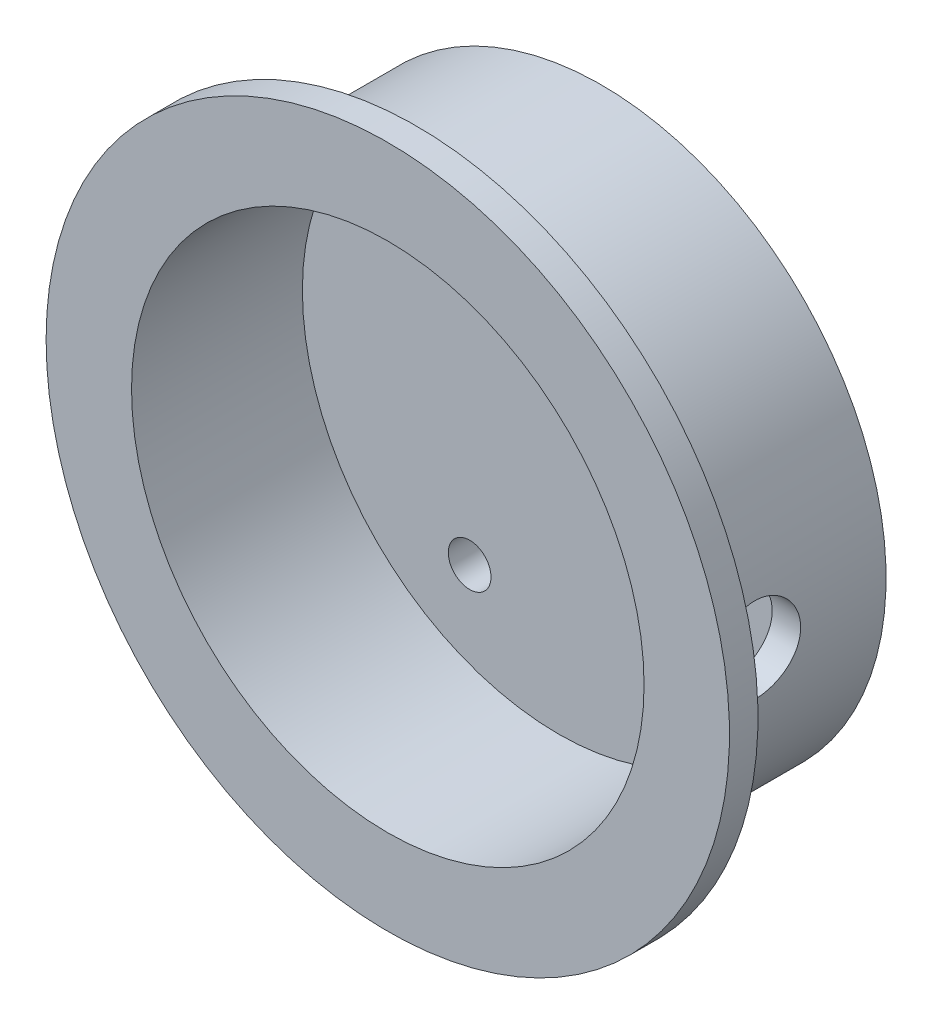
from build123d import *

# Parameters (mm, degrees)
SKETCH_3_R          = 3
CUT_EXTRUDE_1_DEPTH = 75.215901261
SKETCH_4_R          = 6
CUT_EXTRUDE_2_DEPTH = 6


with BuildPart() as part:
    # 草图2 → 旋转2 (revolve)
    with BuildSketch(Plane(origin=(0, 0, 0), x_dir=(1, 0, 0), z_dir=(0, 1, 0)), mode=Mode.PRIVATE) as revolve_2_sk:
        Polygon((0, 0), (40, 0), (40, -26), (48, -26), (48, -30), (36, -30), (36, -6), (0, -6), align=None)
    revolve(revolve_2_sk.sketch.rotate(Axis((0, 0, 0), (0, 0, 1)), 180), axis=Axis((0, 0, 0), (0, 0, 1)))

    # 草图3 → 切除-拉伸1 (cut, through all)
    with BuildSketch(Plane.XY):
        with Locations(Location((25, 0, 0), (0, 0, 180))):
            Circle(SKETCH_3_R)
        with Locations(Location((-12.5, 21.650635, 0), (0, 0, 180))):
            Circle(SKETCH_3_R)
        with Locations(Location((-12.5, -21.650635, 0), (0, 0, 180))):
            Circle(SKETCH_3_R)
    extrude(amount=CUT_EXTRUDE_1_DEPTH, mode=Mode.SUBTRACT)

    # 草图4 → 切除-拉伸2 (cut)
    with BuildSketch(Plane(origin=(40, 0, 0), x_dir=(0, 0, -1), z_dir=(1, 0, 0))):
        with Locations((-18, 0)):
            Circle(SKETCH_4_R)
    extrude(amount=-CUT_EXTRUDE_2_DEPTH, mode=Mode.SUBTRACT)


solid = part.part
